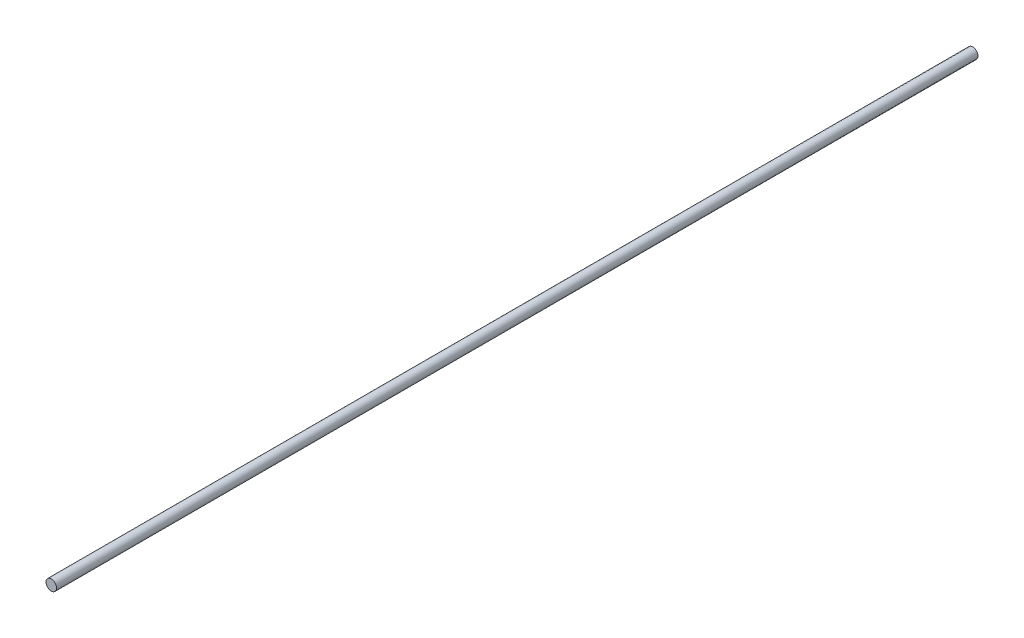
from build123d import *

# Parameters (mm, degrees)
ESQUISSE1_R        = 4
BOSS_EXTRU_1_DEPTH = 700


with BuildPart() as part:
    # Esquisse1 → Boss.-Extru.1 (new body)
    with BuildSketch(Plane.XY):
        Circle(ESQUISSE1_R)
    extrude(amount=BOSS_EXTRU_1_DEPTH)


solid = part.part
